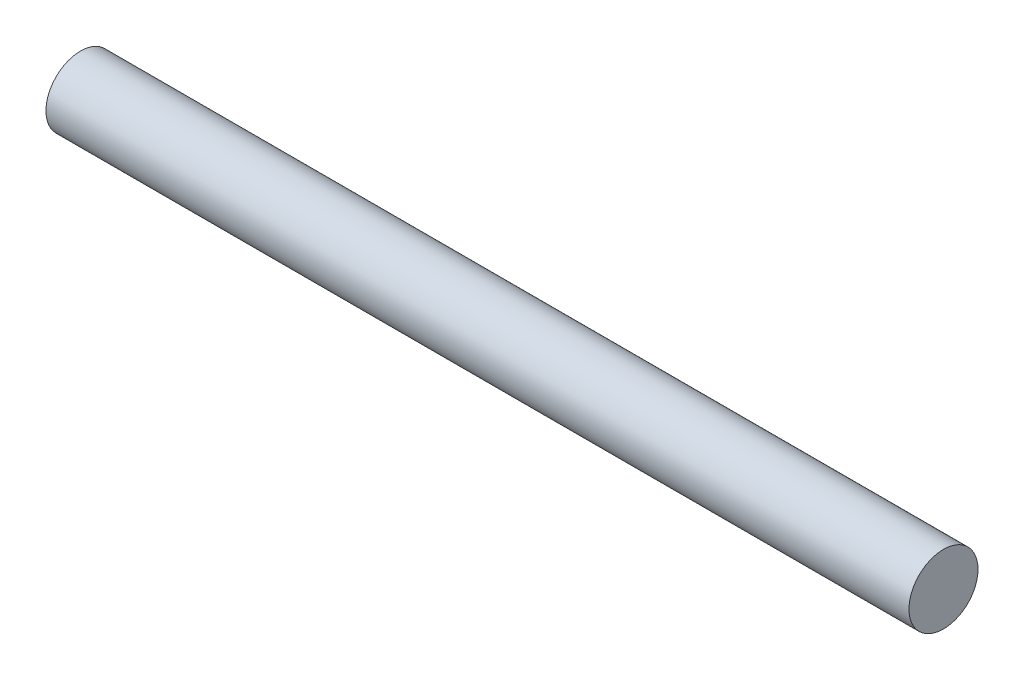
from build123d import *

# Parameters (mm, degrees)
SKETCH2_R           = 4
BOSS_EXTRUDE1_DEPTH = 100


with BuildPart() as part:
    # Sketch2 → Boss-Extrude1 (new body)
    with BuildSketch(Plane(origin=(0, 0, 0), x_dir=(0, 0, -1), z_dir=(1, 0, 0))):
        Circle(SKETCH2_R)
    extrude(amount=BOSS_EXTRUDE1_DEPTH)


solid = part.part
